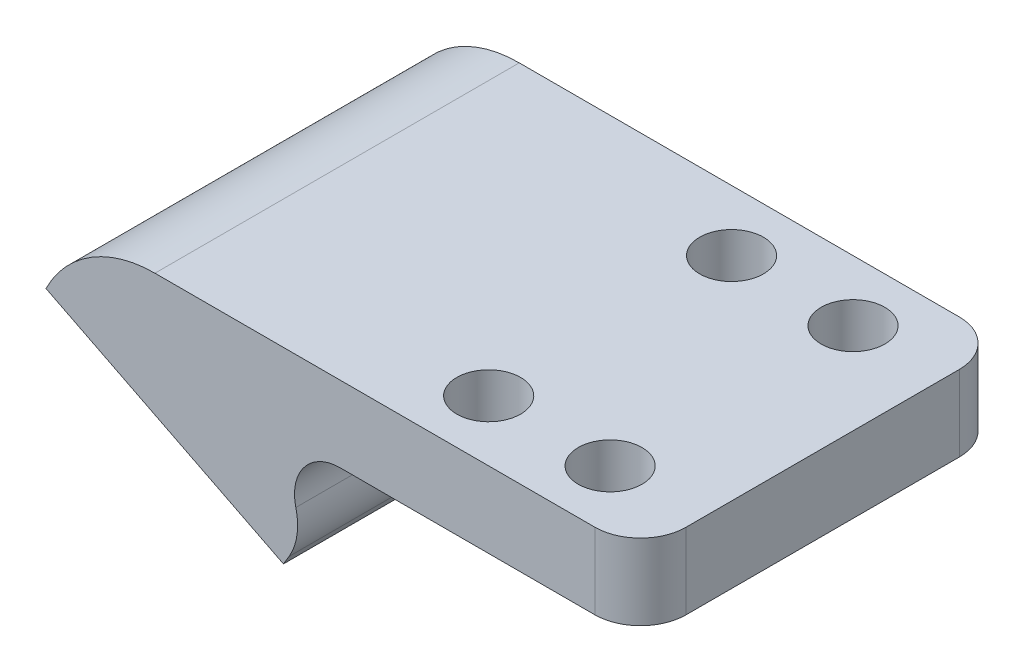
from build123d import *

# Parameters (mm, degrees)
ESQUISSE1_W             = 17
ESQUISSE1_H             = 5
BOSS_EXTRU_1_DEPTH      = 24
BOSS_EXTRU_2_DEPTH      = 24
CONG_1_R                = 4
CONG_2_R                = 8
CONG_3_R                = 3
ESQUISSE3_W             = 24
ESQUISSE3_H             = 5
BOSS_EXTRU_3_DEPTH      = 10
ESQUISSE4_R             = 2.1
ENL_V_MAT_EXTRU_1_DEPTH = 10
CONG_4_R                = 3
BOSS_EXTRU_4_DEPTH      = 5


with BuildPart() as part:
    # Esquisse1 → Boss.-Extru.1 (new body)
    with BuildSketch(Plane.XY):
        with Locations((1.940369129, 2.5)):
            Rectangle(ESQUISSE1_W, ESQUISSE1_H)
    extrude(amount=BOSS_EXTRU_1_DEPTH)

    # Esquisse2 → Boss.-Extru.2 (add)
    with BuildSketch(Plane.XY.offset(24)):
        Polygon((-18.723069156, 0.535871193), (-3.080508445, -7.355303518), (-0.501566554, -3.056100904), (-16.471058056, 5), align=None)
        Polygon((-6.559630871, 0), (-6.559630871, 5), (-16.471058056, 5), align=None)
    extrude(amount=-BOSS_EXTRU_2_DEPTH)

    # Congé1
    cong_1_edges = [part.edges().sort_by_distance(p)[0] for p in [
        (-0.501566554, -3.056100904, 12),
    ]]
    fillet(cong_1_edges, radius=CONG_1_R)

    # Congé2
    cong_2_edges = [part.edges().sort_by_distance(p)[0] for p in [
        (-16.471058056, 5, 12),
    ]]
    fillet(cong_2_edges, radius=CONG_2_R)

    # Congé3
    cong_3_edges = [part.edges().sort_by_distance(p)[0] for p in [
        (-6.559630871, 0, 12),
    ]]
    fillet(cong_3_edges, radius=CONG_3_R)

    # Esquisse3 → Boss.-Extru.3 (add)
    with BuildSketch(Plane(origin=(10.440369129, 0, 0), x_dir=(0, 0, -1), z_dir=(1, 0, 0))):
        with Locations((-12, 2.5)):
            Rectangle(ESQUISSE3_W, ESQUISSE3_H)
    extrude(amount=BOSS_EXTRU_3_DEPTH)

    # Esquisse4 → Enlèv. mat.-Extru.1 (cut)
    with BuildSketch(Plane(origin=(0, 5, 0), x_dir=(1, 0, 0), z_dir=(0, 1, 0))):
        with Locations(Location((6.440369129, -20, 0), (0, 0, 270))):
            Circle(ESQUISSE4_R)
        with Locations(Location((14.440369129, -20, 0), (0, 0, 270))):
            Circle(ESQUISSE4_R)
        with Locations(Location((14.440369129, -4, 0), (0, 0, 270))):
            Circle(ESQUISSE4_R)
        with Locations(Location((6.440369129, -4, 0), (0, 0, 270))):
            Circle(ESQUISSE4_R)
    extrude(amount=-ENL_V_MAT_EXTRU_1_DEPTH, mode=Mode.SUBTRACT)

    # Congé4
    cong_4_edges = [part.edges().sort_by_distance(p)[0] for p in [
        (20.440369129, 2.5, 0),
        (20.440369129, 2.5, 24),
    ]]
    fillet(cong_4_edges, radius=CONG_4_R)

    # Esquisse5 → Boss.-Extru.4 (add)
    with BuildSketch(Plane(origin=(-3.582711985, -7.101957793, 0), x_dir=(0.892825761431464, -0.45040221993716517, 0), z_dir=(-0.45040221993716517, -0.892825761431464, 0))):
        with BuildLine():
            Line((-5.697654158, 17), (-5.697654158, 7))
            ThreePointArc((-5.697654158, 7), (-8.197654158, 4.5), (-10.697654158, 7))
            Line((-10.697654158, 7), (-10.697654158, 17))
            ThreePointArc((-10.697654158, 17), (-8.197654158, 19.5), (-5.697654158, 17))
        make_face()
    extrude(amount=BOSS_EXTRU_4_DEPTH)


solid = part.part
